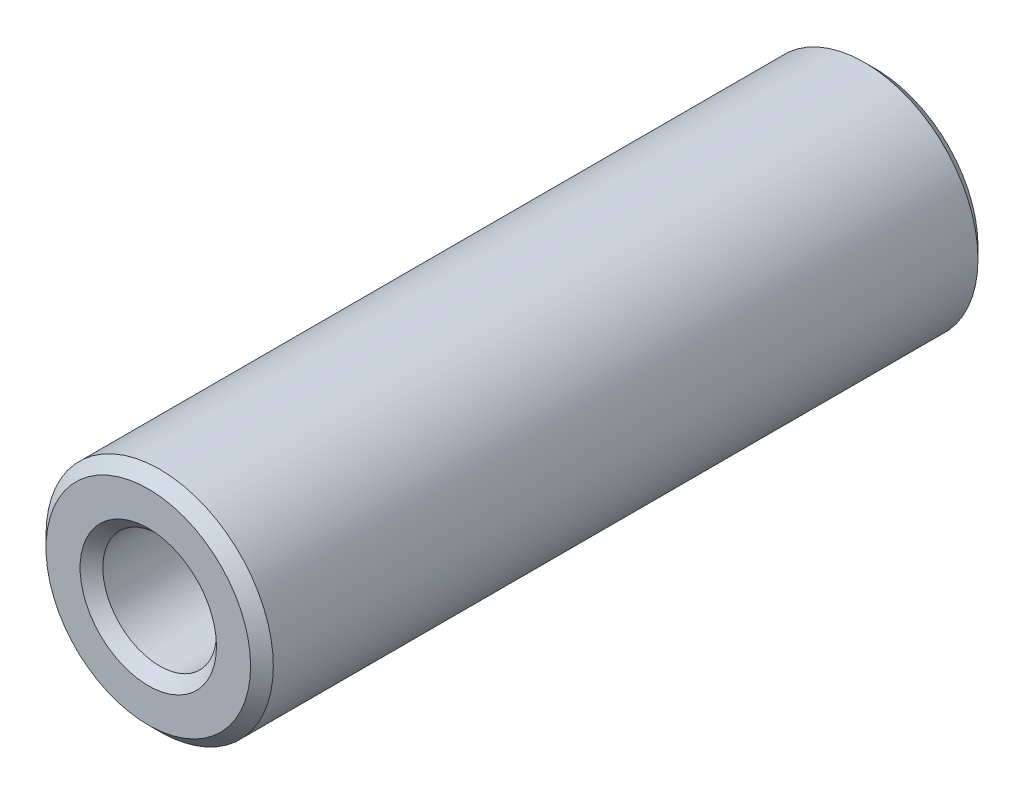
from build123d import *

# Parameters (mm, degrees)
SKETCH1_R           = 5
SKETCH1_R_2         = 2.5
BOSS_EXTRUDE1_DEPTH = 16
CHAMFER1_SIZE       = 0.5


with BuildPart() as part:
    # Sketch1 → Boss-Extrude1 (new, symmetric)
    with BuildSketch(Plane(origin=(0, 0, 0), x_dir=(0, 1, 0), z_dir=(0, 0, 1))):
        with Locations(Location((0, 0, 0), (0, 0, 270))):
            Circle(SKETCH1_R)
        with Locations(Location((0, 0, 0), (0, 0, 270))):
            Circle(SKETCH1_R_2, mode=Mode.SUBTRACT)
    extrude(amount=BOSS_EXTRUDE1_DEPTH, both=True)

    # Chamfer1
    chamfer1_edges = [part.edges().sort_by_distance(p)[0] for p in [
        (-5, 0, -16),
        (-5, 0, 16),
        (-2.5, 0, -16),
        (-2.5, 0, 16),
    ]]
    chamfer(chamfer1_edges, length=CHAMFER1_SIZE)


solid = part.part
